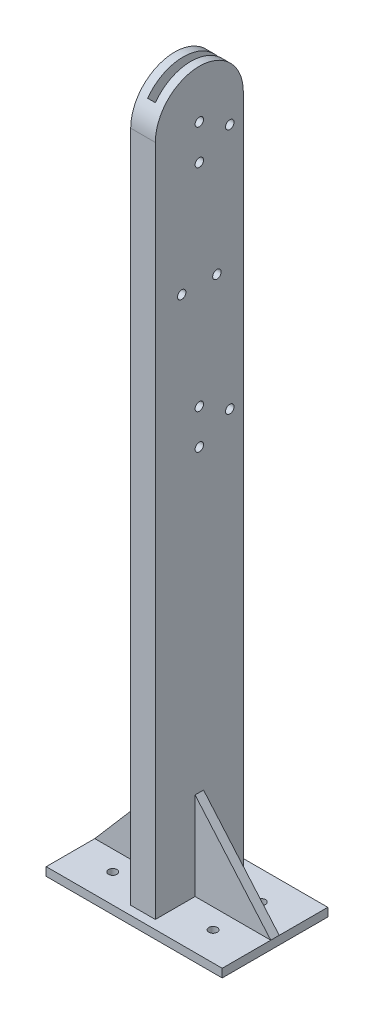
from build123d import *

# Parameters (mm, degrees)
SKETCH2_W               = 35
SKETCH2_H               = 125
SKETCH2_W_2             = 11
SKETCH2_H_2             = 101
BOSS_EXTRUDE1_DEPTH     = 1400
SKETCH3_R               = 6
CUT_EXTRUDE1_DEPTH      = 1407.004978654
SKETCH4_W               = 250
SKETCH4_H               = 150
BOSS_EXTRUDE2_DEPTH     = 12
SKETCH5_W               = 250
SKETCH5_H               = 150
BOSS_EXTRUDE3_DEPTH     = 12
BOSS_EXTRUDE4_START     = -62.5
BOSS_EXTRUDE4_DEPTH     = 6
SKETCH8_R               = 6
CUT_EXTRUDE2_DEPTH      = 12
CUT_EXTRUDE3_DEPTH      = 1426.81783549
CUT_EXTRUDE3_DEPTH_BACK = 1426.81783549


with BuildPart() as part:
    # Sketch2 → Boss-Extrude1 (new body)
    with BuildSketch(Plane(origin=(0, 0, 0), x_dir=(1, 0, 0), z_dir=(0, 1, 0))):
        with Locations((17.5, 62.5)):
            Rectangle(SKETCH2_W, SKETCH2_H)
        with Locations((17.5, 62.5)):
            Rectangle(SKETCH2_W_2, SKETCH2_H_2, mode=Mode.SUBTRACT)
    extrude(amount=BOSS_EXTRUDE1_DEPTH)

    # Sketch3 → Cut-Extrude1 (cut, through all)
    with BuildSketch(Plane(origin=(35, 0, 0), x_dir=(0, 0, -1), z_dir=(1, 0, 0))):
        with Locations((62.5, 950)):
            Circle(SKETCH3_R)
        with Locations((62.5, 900)):
            Circle(SKETCH3_R)
        with Locations((105.801270189, 925)):
            Circle(SKETCH3_R)
        with Locations((37.5, 750)):
            Circle(SKETCH3_R)
        with Locations((87.5, 750)):
            Circle(SKETCH3_R)
        with Locations((105.801270189, 575)):
            Circle(SKETCH3_R)
        with Locations((62.5, 600)):
            Circle(SKETCH3_R)
        with Locations((62.5, 550)):
            Circle(SKETCH3_R)
    extrude(amount=-CUT_EXTRUDE1_DEPTH, mode=Mode.SUBTRACT)

    # Sketch4 → Boss-Extrude2 (add)
    with BuildSketch(Plane(origin=(0, 0, 0), x_dir=(-1, 0, 0), z_dir=(0, -1, 0))):
        with Locations((-17.5, 62.5)):
            Rectangle(SKETCH4_W, SKETCH4_H)
    extrude(amount=BOSS_EXTRUDE2_DEPTH)

    # Sketch5 → Boss-Extrude3 (add)
    with BuildSketch(Plane(origin=(0, 1400, 0), x_dir=(1, 0, 0), z_dir=(0, 1, 0))):
        with Locations((17.5, 62.5)):
            Rectangle(SKETCH5_W, SKETCH5_H)
    extrude(amount=BOSS_EXTRUDE3_DEPTH)

    # Sketch7 → Boss-Extrude4 (add, symmetric)
    with BuildSketch(Plane(origin=(0, 0, -125), x_dir=(-1, 0, 0), z_dir=(0, 0, -1)).offset(BOSS_EXTRUDE4_START)):
        Polygon((-35, 0), (-35, 125), (-142.5, 0), align=None)
        Polygon((0, 125), (107.5, 0), (0, 0), align=None)
    extrude(amount=BOSS_EXTRUDE4_DEPTH, both=True)

    # Sketch8 → Cut-Extrude2 (cut)
    with BuildSketch(Plane(origin=(0, 0, 0), x_dir=(1, 0, 0), z_dir=(0, 1, 0))):
        with Locations(Location((-53.75, 28.25, 0), (0, 0, 270))):
            Circle(SKETCH8_R)
        with Locations(Location((-53.75, 96.75, 0), (0, 0, 270))):
            Circle(SKETCH8_R)
        with Locations(Location((88.75, 28.25, 0), (0, 0, 270))):
            Circle(SKETCH8_R)
        with Locations(Location((88.75, 96.75, 0), (0, 0, 270))):
            Circle(SKETCH8_R)
    extrude(amount=-CUT_EXTRUDE2_DEPTH, mode=Mode.SUBTRACT)

    # Sketch9 → Cut-Extrude3 (cut, two sides: drawn at the far end of the back side and taken through both)
    with BuildSketch(Plane(origin=(35, 0, 0), x_dir=(0, 0, -1), z_dir=(1, 0, 0)).offset(-CUT_EXTRUDE3_DEPTH_BACK)):
        with BuildLine():
            Line((-163.728557717, 1439.709556919), (272.302726902, 1439.709556919))
            Line((272.302726902, 1439.709556919), (272.302726902, 682.852602279))
            Line((272.302726902, 682.852602279), (125, 682.852602279))
            Line((125, 682.852602279), (125, 956))
            ThreePointArc((125, 956), (62.5, 1018.5), (0, 956))
            Line((0, 956), (0, 682.852602279))
            Line((0, 682.852602279), (-163.728557717, 682.852602279))
            Line((-163.728557717, 682.852602279), (-163.728557717, 1439.709556919))
        make_face()
    extrude(amount=CUT_EXTRUDE3_DEPTH + CUT_EXTRUDE3_DEPTH_BACK, mode=Mode.SUBTRACT)


solid = part.part
